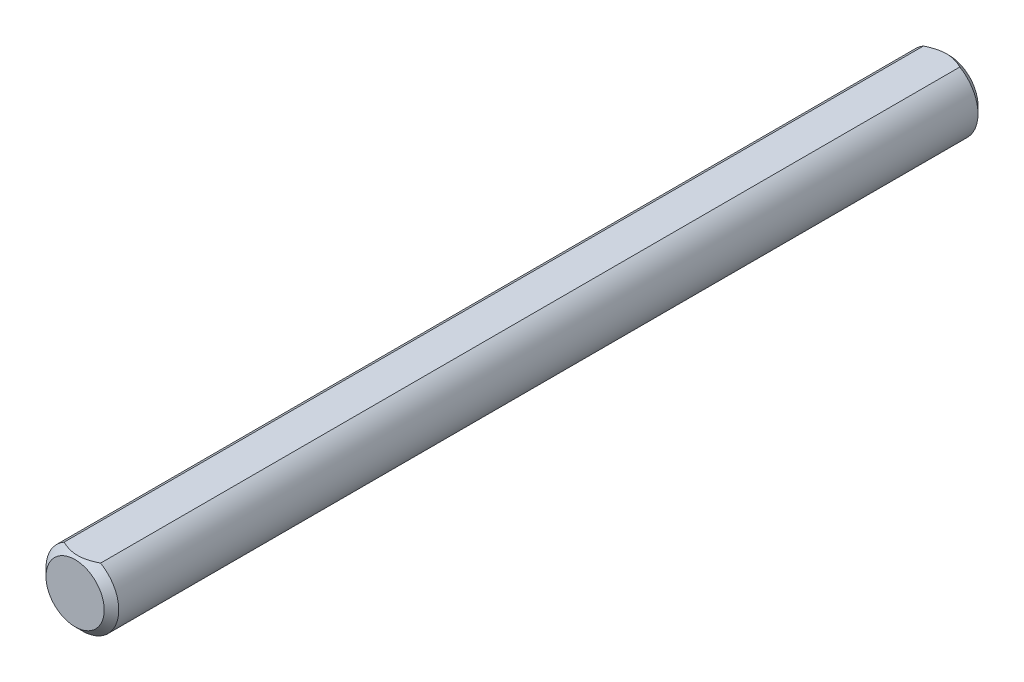
from build123d import *

# Parameters (mm, degrees)
SKETCH1_R           = 3.175
EXTRUDE1_DEPTH      = 38.1
CHAMFER1_SIZE       = 0.635
EXTRUDE7_DEPTH      = 39.363670966
EXTRUDE7_DEPTH_BACK = 39.363670966


with BuildPart() as part:
    # Sketch1 → Extrude1 (new, symmetric)
    with BuildSketch(Plane.XY):
        with Locations(Location((0, 0, 0), (0, 0, 180))):
            Circle(SKETCH1_R)
    extrude(amount=EXTRUDE1_DEPTH, both=True)

    # Chamfer1
    chamfer1_edges = [part.edges().sort_by_distance(p)[0] for p in [
        (3.175, 0, -38.1),
        (3.175, 0, 38.1),
    ]]
    chamfer(chamfer1_edges, length=CHAMFER1_SIZE)

    # Sketch13 → Extrude7 (cut, two sides: drawn at the far end of the back side and taken through both)
    with BuildSketch(Plane.XY.offset(-EXTRUDE7_DEPTH_BACK)):
        with BuildLine():
            Line((-1.5875, 2.749630657), (1.5875, 2.749630657))
            ThreePointArc((1.5875, 2.749630657), (0, 3.175), (-1.5875, 2.749630657))
        make_face()
    extrude(amount=EXTRUDE7_DEPTH + EXTRUDE7_DEPTH_BACK, mode=Mode.SUBTRACT)


solid = part.part
